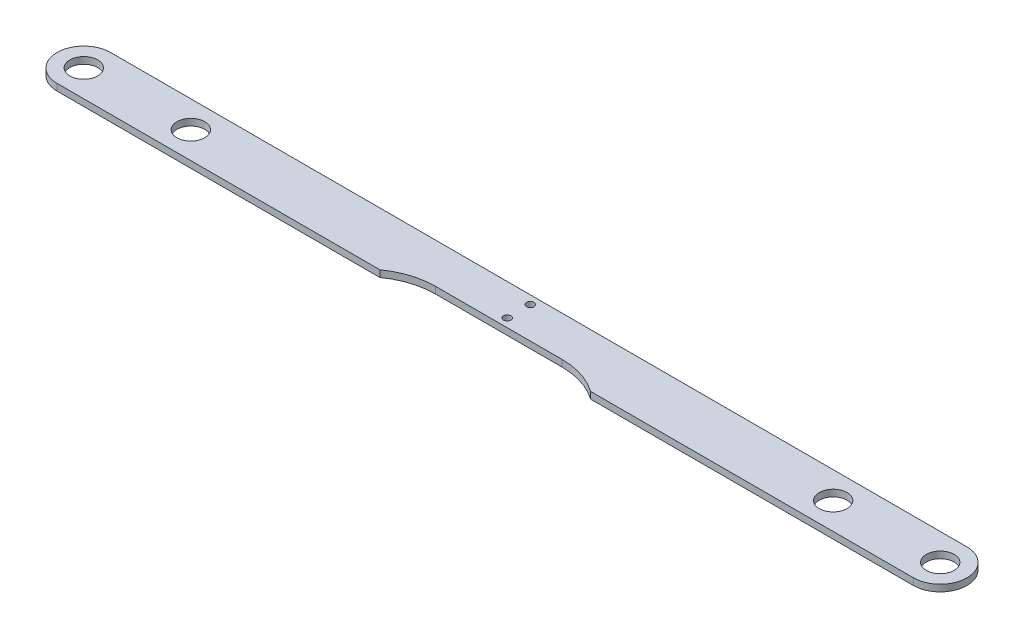
from build123d import *

# Parameters (mm, degrees)
SKETCH5_R           = 3.302
SKETCH5_R_2         = 0.889
BOSS_EXTRUDE1_DEPTH = 1.5875


with BuildPart() as part:
    # Sketch5 → Boss-Extrude1 (new body)
    with BuildSketch(Plane(origin=(0, 0, 0), x_dir=(1, 0, 0), z_dir=(0, 1, 0))):
        with BuildLine():
            Line((101.6, 4.75), (-101.6, 4.75))
            ThreePointArc((-101.6, 4.75), (-107.95, -1.6), (-101.6, -7.95))
            Line((-101.6, -7.95), (-25, -7.95))
            ThreePointArc((-25, -7.95), (-20.249761899, -5.569494064), (-15, -4.75))
            Line((-15, -4.75), (15, -4.75))
            ThreePointArc((15, -4.75), (20.249761899, -5.569494064), (25, -7.95))
            Line((25, -7.95), (101.6, -7.95))
            ThreePointArc((101.6, -7.95), (107.95, -1.6), (101.6, 4.75))
        make_face()
        with Locations(Location((-101.6, -1.6, 0), (0, 0, 270))):
            Circle(SKETCH5_R, mode=Mode.SUBTRACT)
        with Locations(Location((0, 2.75, 0), (0, 0, 270))):
            Circle(SKETCH5_R_2, mode=Mode.SUBTRACT)
        with Locations(Location((101.6, -1.6, 0), (0, 0, 270))):
            Circle(SKETCH5_R, mode=Mode.SUBTRACT)
        with Locations(Location((0, -2.75, 0), (0, 0, 270))):
            Circle(SKETCH5_R_2, mode=Mode.SUBTRACT)
        with Locations(Location((-76.2, -1.6, 0), (0, 0, 270))):
            Circle(SKETCH5_R, mode=Mode.SUBTRACT)
        with Locations(Location((76.2, -1.6, 0), (0, 0, 270))):
            Circle(SKETCH5_R, mode=Mode.SUBTRACT)
    extrude(amount=BOSS_EXTRUDE1_DEPTH)


solid = part.part
